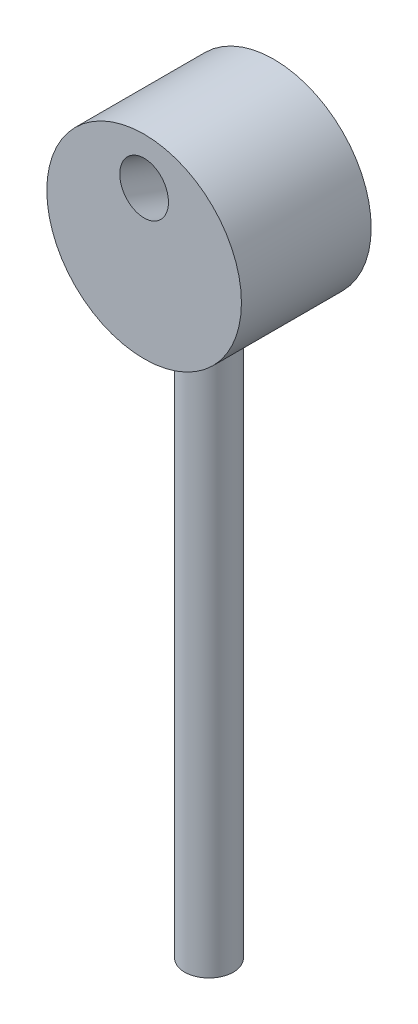
from build123d import *

# Parameters (mm, degrees)
SKETCH1_R                = 1.5
BOSS_EXTRUDE1_DEPTH      = 1
BOSS_EXTRUDE2_REACH      = 13.64
BOSS_EXTRUDE2_END_RADIUS = 1.5
SKETCH6_R                = 0.375
SKETCH7_R                = 0.375
CUT_EXTRUDE1_DEPTH       = 5


with BuildPart() as part:
    # Sketch1 → Boss-Extrude1 (new, symmetric)
    with BuildSketch(Plane.XY):
        Circle(SKETCH1_R)
    extrude(amount=BOSS_EXTRUDE1_DEPTH, both=True)

    # Boss-Extrude2: up to this cylinder (the profile starts outside it)
    boss_extrude2_end = Plane(origin=(0, 0, 0), z_dir=(0, 0, -1)) * Cylinder(BOSS_EXTRUDE2_END_RADIUS, 31.28, mode=Mode.PRIVATE)
    # Sketch6 → Boss-Extrude2 (add, up to the surface)
    with BuildSketch(Plane(origin=(0, -10, 0), x_dir=(1, 0, 0), z_dir=(0, 1, 0)), mode=Mode.PRIVATE) as boss_extrude2_sk1:
        with Locations(Location((0, 0, 0), (0, 0, 90))):
            Circle(SKETCH6_R)
    boss_extrude2_tool1 = extrude(boss_extrude2_sk1.sketch, amount=BOSS_EXTRUDE2_REACH, mode=Mode.PRIVATE) - boss_extrude2_end
    add(boss_extrude2_tool1.solids().sort_by_distance((0, -10, 0))[0])

    # Sketch7 → Cut-Extrude1 (cut, symmetric)
    with BuildSketch(Plane(origin=(0, 0.78, 1), x_dir=(-1, 0, 0), z_dir=(0, -0.34202014332566943, -0.9396926207859082))):
        with Locations(Location((0, 0, 0), (0, 0, 270))):
            Circle(SKETCH7_R)
    extrude(amount=CUT_EXTRUDE1_DEPTH, both=True, mode=Mode.SUBTRACT)


solid = part.part
